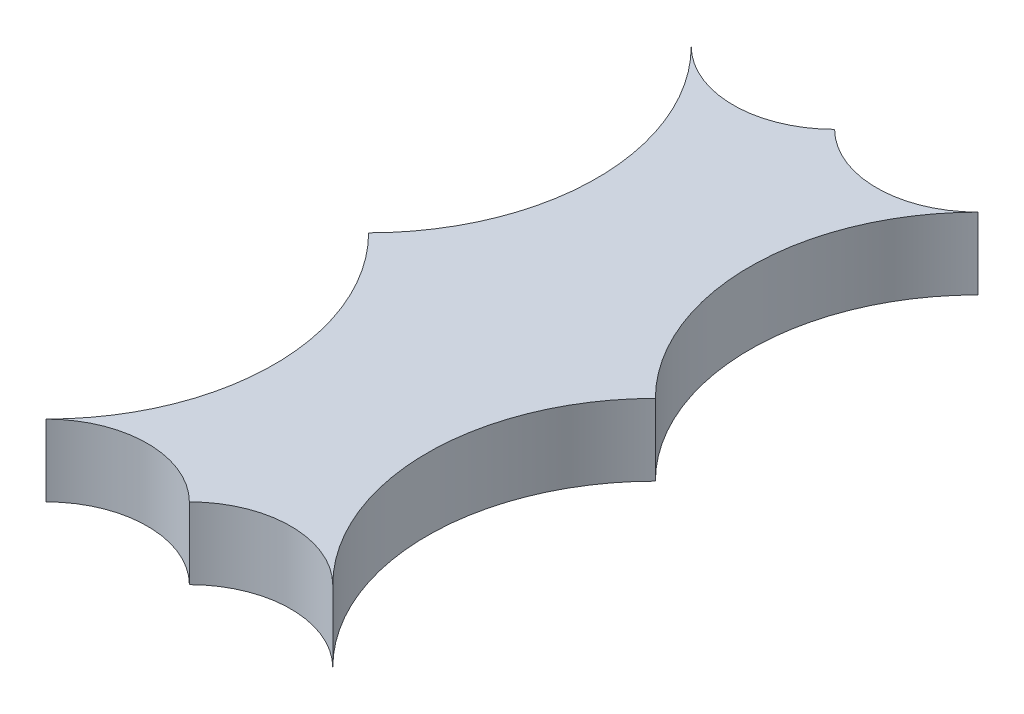
from build123d import *

# Parameters (mm, degrees)
BOSS_EXTRUDE1_DEPTH = 4


with BuildPart() as part:
    # Sketch1 → Boss-Extrude1 (new body)
    with BuildSketch(Plane(origin=(0, 0, 0), x_dir=(1, 0, 0), z_dir=(0, 1, 0))):
        with BuildLine():
            ThreePointArc((21.950066158, 45.238052293), (25.677988219, 36.238052293), (21.950066158, 27.238052293))
            ThreePointArc((21.950066158, 27.238052293), (25.677988219, 18.238052293), (21.950066158, 9.238052293))
            ThreePointArc((21.950066158, 9.238052293), (25.950066158, 10.894906543), (29.950066158, 9.238052293))
            ThreePointArc((29.950066158, 9.238052293), (33.950066158, 10.894906543), (37.950066158, 9.238052293))
            ThreePointArc((37.950066158, 9.238052293), (34.222144097, 18.238052293), (37.950066158, 27.238052293))
            ThreePointArc((37.950066158, 27.238052293), (34.222144097, 36.238052293), (37.950066158, 45.238052293))
            ThreePointArc((37.950066158, 45.238052293), (33.950066158, 43.581198044), (29.950066158, 45.238052293))
            ThreePointArc((29.950066158, 45.238052293), (25.950066158, 43.581198044), (21.950066158, 45.238052293))
        make_face()
    extrude(amount=BOSS_EXTRUDE1_DEPTH)


solid = part.part
